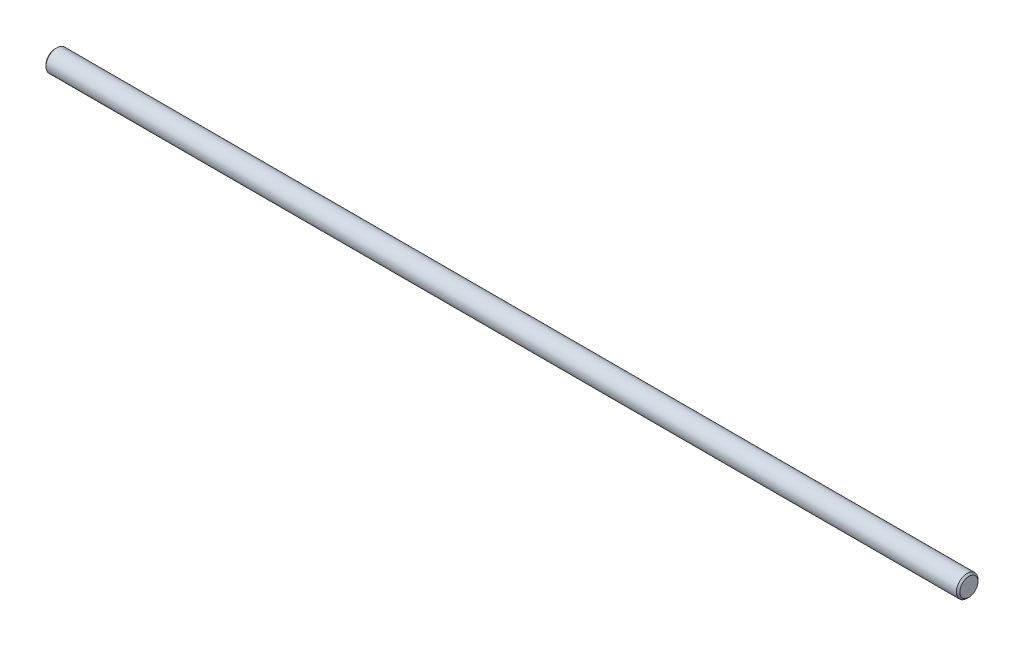
from build123d import *

# Parameters (mm, degrees)
SKETCH1_R           = 6.35
BOSS_EXTRUDE1_DEPTH = 268
CHAMFER1_SIZE       = 1


with BuildPart() as part:
    # Sketch1 → Boss-Extrude1 (new, symmetric)
    with BuildSketch(Plane(origin=(0, 0, 0), x_dir=(0, 0, -1), z_dir=(1, 0, 0))):
        Circle(SKETCH1_R)
    extrude(amount=BOSS_EXTRUDE1_DEPTH, both=True)

    # Chamfer1
    chamfer1_edges = [part.edges().sort_by_distance(p)[0] for p in [
        (-268, 0, 6.35),
        (268, 0, 6.35),
    ]]
    chamfer(chamfer1_edges, length=CHAMFER1_SIZE)


solid = part.part
